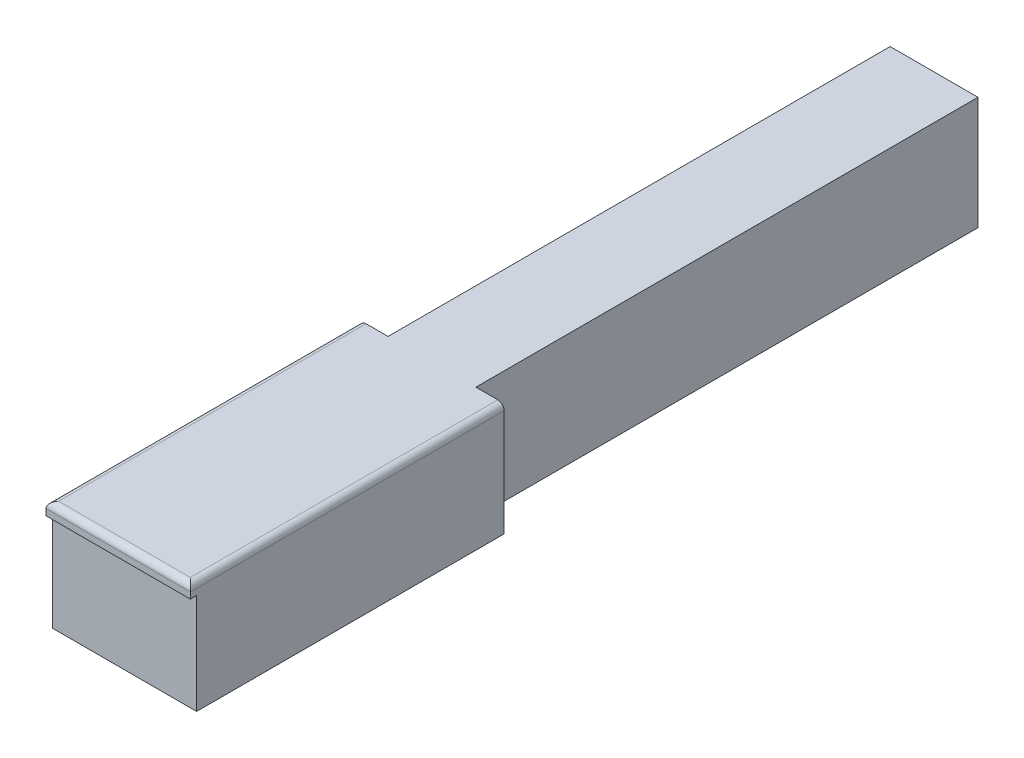
from build123d import *

# Parameters (mm, degrees)
SALIENTE_EXTRUIR1_DEPTH = 18
CROQUIS3_W              = 23
CROQUIS3_H              = 16
CORTAR_EXTRUIR1_DEPTH   = 1
REDONDEO1_R             = 1


with BuildPart() as part:
    # Croquis2 → Saliente-Extruir1 (new body)
    with BuildSketch(Plane(origin=(0, 0, 0), x_dir=(1, 0, 0), z_dir=(0, 1, 0))):
        Polygon((0, 50), (0, 0), (23, 0), (23, 50), (18.5, 50), (18.5, 130), (4.5, 130), (4.5, 50), align=None)
    extrude(amount=SALIENTE_EXTRUIR1_DEPTH)

    # Croquis3 → Cortar-Extruir1 (cut)
    with BuildSketch(Plane.XY):
        with Locations((11.5, 8)):
            Rectangle(CROQUIS3_W, CROQUIS3_H)
    extrude(amount=-CORTAR_EXTRUIR1_DEPTH, mode=Mode.SUBTRACT)

    # Redondeo1
    redondeo1_edges = [part.edges().sort_by_distance(p)[0] for p in [
        (0, 18, -25),
        (11.5, 18, 0),
        (23, 18, -25),
    ]]
    fillet(redondeo1_edges, radius=REDONDEO1_R)


solid = part.part
